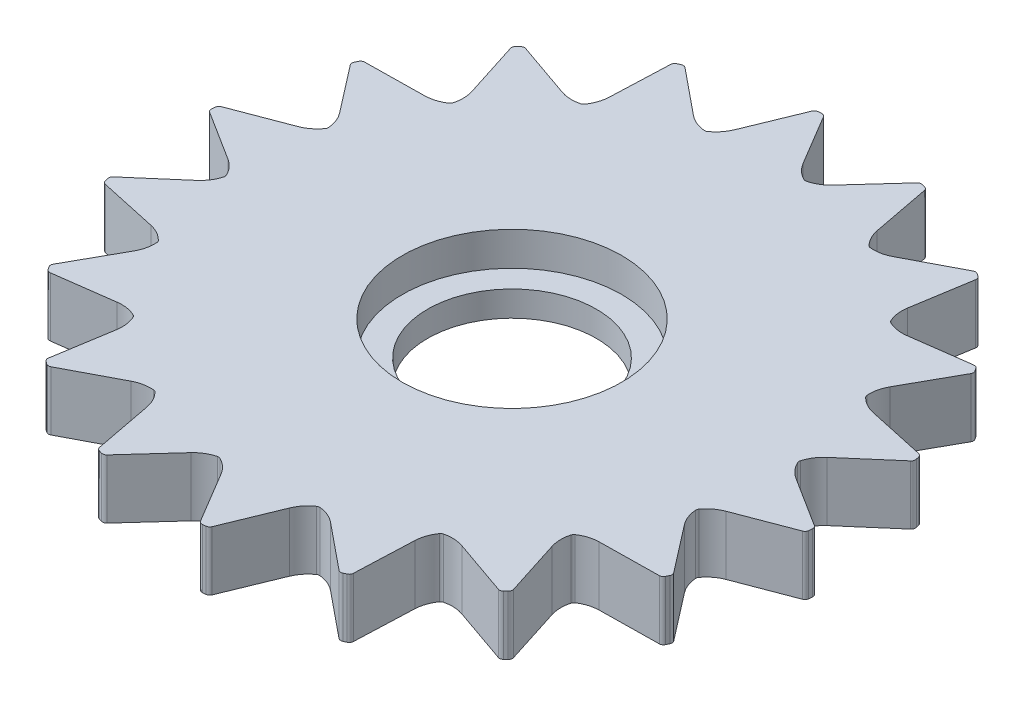
from build123d import *

# Parameters (mm, degrees)
SKETCH1_R           = 10
BOSS_EXTRUDE1_DEPTH = 7
SKETCH2_R           = 13
CUT_EXTRUDE1_DEPTH  = 4


with BuildPart() as part:
    # Sketch1 → Boss-Extrude1 (new body)
    with BuildSketch(Plane(origin=(0, 0, 0), x_dir=(1, 0, 0), z_dir=(0, 1, 0))):
        with BuildLine():
            Line((381.346685097, 381.313283118), (386.661883303, 385.905742972))
            ThreePointArc((386.661883303, 385.905742972), (387.416091655, 386.776668476), (387.890781792, 387.826435472))
            ThreePointArc((387.890781792, 387.826435472), (387.908892338, 388.001853093), (387.864976279, 388.172647453))
            ThreePointArc((387.864976279, 388.172647453), (387.239903701, 389.14044172), (386.364914825, 389.889932173))
            Line((386.364914825, 389.889932173), (380.427618413, 393.643667751))
            ThreePointArc((380.427618413, 393.643667751), (380.245877192, 393.84615623), (380.197077012, 394.113831403))
            ThreePointArc((380.197077012, 394.113831403), (380.215965011, 394.306577637), (380.235797819, 394.499228946))
            ThreePointArc((380.235797819, 394.499228946), (380.336871676, 394.751846307), (380.555261847, 394.914133672))
            Line((380.555261847, 394.914133672), (387.120628157, 397.411729455))
            ThreePointArc((387.120628157, 397.411729455), (388.127226245, 397.972177276), (388.932330522, 398.796281987))
            ThreePointArc((388.932330522, 398.796281987), (389.009345229, 398.95492646), (389.026492744, 399.130440836))
            ThreePointArc((389.026492744, 399.130440836), (388.770121789, 400.25365738), (388.204242031, 401.257211849))
            Line((388.204242031, 401.257211849), (383.908861585, 406.815244442))
            ThreePointArc((383.908861585, 406.815244442), (383.807335839, 407.06768053), (383.853028972, 407.335903559))
            ThreePointArc((383.853028972, 407.335903559), (383.936700979, 407.510565697), (384.021228351, 407.68481549))
            ThreePointArc((384.021228351, 407.68481549), (384.202606935, 407.887628866), (384.463332115, 407.965435268))
            Line((384.463332115, 407.965435268), (391.486986457, 408.066920068))
            ThreePointArc((391.486986457, 408.066920068), (392.624563696, 408.249291928), (393.662974656, 408.748335163))
            ThreePointArc((393.662974656, 408.748335163), (393.789604412, 408.871071622), (393.865747258, 409.030136391))
            ThreePointArc((393.865747258, 409.030136391), (394.009000047, 410.17329872), (393.820482857, 411.309873724))
            Line((393.820482857, 411.309873724), (391.685104653, 418.001822573))
            ThreePointArc((391.685104653, 418.001822573), (391.676039886, 418.273758753), (391.810715064, 418.510177982))
            ThreePointArc((391.810715064, 418.510177982), (391.949079002, 418.645689192), (392.088105689, 418.780520374))
            ThreePointArc((392.088105689, 418.780520374), (392.327912065, 418.909067477), (392.599524949, 418.893008315))
            Line((392.599524949, 418.893008315), (399.234310951, 416.586141569))
            ThreePointArc((399.234310951, 416.586141569), (400.365658739, 416.368440729), (401.512128694, 416.482230509))
            ThreePointArc((401.512128694, 416.482230509), (401.673100083, 416.554255127), (401.799054308, 416.677684729))
            ThreePointArc((401.799054308, 416.677684729), (402.32465244, 417.702910594), (402.536235774, 418.835418415))
            Line((402.536235774, 418.835418415), (402.818417938, 425.854135727))
            ThreePointArc((402.818417938, 425.854135727), (402.902907494, 426.112772481), (403.110320904, 426.288872263))
            ThreePointArc((403.110320904, 426.288872263), (403.286688038, 426.368887893), (403.46344537, 426.448037832))
            ThreePointArc((403.46344537, 426.448037832), (403.732755351, 426.486813985), (403.982495417, 426.378826232))
            Line((403.982495417, 426.378826232), (409.428159969, 421.941850114))
            ThreePointArc((409.428159969, 421.941850114), (410.416821063, 421.350334508), (411.533068817, 421.065146107))
            ThreePointArc((411.533068817, 421.065146107), (411.708966313, 421.077771651), (411.86953998, 421.150678655))
            ThreePointArc((411.86953998, 421.150678655), (412.714088563, 421.934310687), (413.300252348, 422.926154167))
            Line((413.300252348, 422.926154167), (415.965959546, 429.425079049))
            ThreePointArc((415.965959546, 429.425079049), (416.133812738, 429.639220968), (416.388947262, 429.733761069))
            ThreePointArc((416.388947262, 429.733761069), (416.582045114, 429.748630054), (416.775213547, 429.762552099))
            ThreePointArc((416.775213547, 429.762552099), (417.041544374, 429.706880326), (417.239289285, 429.519988898))
            Line((417.239289285, 429.519988898), (420.839004872, 423.488068211))
            ThreePointArc((420.839004872, 423.488068211), (421.565732155, 422.594083352), (422.517121754, 421.944314699))
            ThreePointArc((422.517121754, 421.944314699), (422.686729524, 421.896018342), (422.862555077, 421.909609088))
            ThreePointArc((422.862555077, 421.909609088), (423.924189089, 422.357129698), (424.814233321, 423.088677876))
            Line((424.814233321, 423.088677876), (429.541941924, 428.283944072))
            ThreePointArc((429.541941924, 428.283944072), (429.77291318, 428.427762481), (430.044995827, 428.42933997))
            ThreePointArc((430.044995827, 428.42933997), (430.231533946, 428.37726889), (430.417814518, 428.324283838))
            ThreePointArc((430.417814518, 428.324283838), (430.649042763, 428.180878975), (430.770941563, 427.937625736))
            Line((430.770941563, 427.937625736), (432.090529359, 421.038299137))
            ThreePointArc((432.090529359, 421.038299137), (432.467668795, 419.949672793), (433.139448613, 419.013695577))
            ThreePointArc((433.139448613, 419.013695577), (433.282309456, 418.910302574), (433.452179739, 418.862937816))
            ThreePointArc((433.452179739, 418.862937816), (434.60285045, 418.920369414), (435.689422659, 419.303386783))
            Line((435.689422659, 419.303386783), (441.908901235, 422.568368516))
            ThreePointArc((441.908901235, 422.568368516), (442.175132013, 422.624516792), (442.431345602, 422.5329414))
            ThreePointArc((442.431345602, 422.5329414), (442.588824738, 422.420210796), (442.745749262, 422.306709426))
            ThreePointArc((442.745749262, 422.306709426), (442.913985386, 422.092868218), (442.945335281, 421.822593099))
            Line((442.945335281, 421.822593099), (441.825633523, 414.888021198))
            ThreePointArc((441.825633523, 414.888021198), (441.807696529, 413.736057772), (442.118840005, 412.626764659))
            ThreePointArc((442.118840005, 412.626764659), (442.217722796, 412.480745731), (442.361148947, 412.378138359))
            ThreePointArc((442.361148947, 412.378138359), (443.462068485, 412.038553847), (444.614112028, 412.026842858))
            Line((444.614112028, 412.026842858), (451.575199671, 412.967735147))
            ThreePointArc((451.575199671, 412.967735147), (451.84457861, 412.929440978), (452.054020001, 412.75575805))
            ThreePointArc((452.054020001, 412.75575805), (452.163445845, 412.595964897), (452.272086907, 412.435637149))
            ThreePointArc((452.272086907, 412.435637149), (452.35703915, 412.177152), (452.294058881, 411.91245417))
            Line((452.294058881, 411.91245417), (448.870120126, 405.779048682))
            ThreePointArc((448.870120126, 405.779048682), (448.459270169, 404.702691964), (448.372248808, 403.553880076))
            ThreePointArc((448.372248808, 403.553880076), (448.415226822, 403.38284726), (448.51490953, 403.237373237))
            ThreePointArc((448.51490953, 403.237373237), (449.433290753, 402.541731518), (450.511852175, 402.136704691))
            Line((450.511852175, 402.136704691), (457.374938981, 400.640022038))
            ThreePointArc((457.374938981, 400.640022038), (457.614975004, 400.511904267), (457.752382474, 400.277062527))
            ThreePointArc((457.752382474, 400.277062527), (457.800556656, 400.089480237), (457.84781054, 399.901664003))
            ThreePointArc((457.84781054, 399.901664003), (457.839232409, 399.629712038), (457.689518325, 399.402517961))
            Line((457.689518325, 399.402517961), (452.374320118, 394.810058108))
            ThreePointArc((452.374320118, 394.810058108), (451.620111767, 393.939132604), (451.14542163, 392.889365608))
            ThreePointArc((451.14542163, 392.889365608), (451.127311084, 392.713947987), (451.171227142, 392.543153627))
            ThreePointArc((451.171227142, 392.543153627), (451.79629972, 391.575359359), (452.671288596, 390.825868907))
            Line((452.671288596, 390.825868907), (458.608585009, 387.072133329))
            ThreePointArc((458.608585009, 387.072133329), (458.79032623, 386.86964485), (458.839126409, 386.601969677))
            ThreePointArc((458.839126409, 386.601969677), (458.820238411, 386.409223443), (458.800405602, 386.216572134))
            ThreePointArc((458.800405602, 386.216572134), (458.699331746, 385.963954772), (458.480941575, 385.801667407))
            Line((458.480941575, 385.801667407), (451.915575265, 383.304071624))
            ThreePointArc((451.915575265, 383.304071624), (450.908977177, 382.743623803), (450.103872899, 381.919519092))
            ThreePointArc((450.103872899, 381.919519092), (450.026858193, 381.76087462), (450.009710678, 381.585360243))
            ThreePointArc((450.009710678, 381.585360243), (450.266081633, 380.462143699), (450.831961391, 379.458589231))
            Line((450.831961391, 379.458589231), (455.127341836, 373.900556638))
            ThreePointArc((455.127341836, 373.900556638), (455.228867582, 373.64812055), (455.18317445, 373.37989752))
            ThreePointArc((455.18317445, 373.37989752), (455.099502442, 373.205235383), (455.01497507, 373.030985589))
            ThreePointArc((455.01497507, 373.030985589), (454.833596487, 372.828172214), (454.572871307, 372.750365812))
            Line((454.572871307, 372.750365812), (447.549216965, 372.648881011))
            ThreePointArc((447.549216965, 372.648881011), (446.411639725, 372.466509152), (445.373228766, 371.967465917))
            ThreePointArc((445.373228766, 371.967465917), (445.246599009, 371.844729457), (445.170456163, 371.685664689))
            ThreePointArc((445.170456163, 371.685664689), (445.027203375, 370.54250236), (445.215720564, 369.405927355))
            Line((445.215720564, 369.405927355), (447.351098768, 362.713978506))
            ThreePointArc((447.351098768, 362.713978506), (447.360163536, 362.442042326), (447.225488357, 362.205623097))
            ThreePointArc((447.225488357, 362.205623097), (447.08712442, 362.070111887), (446.948097733, 361.935280706))
            ThreePointArc((446.948097733, 361.935280706), (446.708291357, 361.806733603), (446.436678472, 361.822792764))
            Line((446.436678472, 361.822792764), (439.80189247, 364.12965951))
            ThreePointArc((439.80189247, 364.12965951), (438.670544683, 364.347360351), (437.524074728, 364.23357057))
            ThreePointArc((437.524074728, 364.23357057), (437.363103339, 364.161545953), (437.237149114, 364.03811635))
            ThreePointArc((437.237149114, 364.03811635), (436.711550982, 363.012890485), (436.499967648, 361.880382664))
            Line((436.499967648, 361.880382664), (436.217785484, 354.861665352))
            ThreePointArc((436.217785484, 354.861665352), (436.133295928, 354.603028598), (435.925882518, 354.426928816))
            ThreePointArc((435.925882518, 354.426928816), (435.749515384, 354.346913186), (435.572758052, 354.267763247))
            ThreePointArc((435.572758052, 354.267763247), (435.303448071, 354.228987094), (435.053708004, 354.336974848))
            Line((435.053708004, 354.336974848), (429.608043453, 358.773950966))
            ThreePointArc((429.608043453, 358.773950966), (428.619382358, 359.365466571), (427.503134605, 359.650654972))
            ThreePointArc((427.503134605, 359.650654972), (427.327237108, 359.638029428), (427.166663442, 359.565122424))
            ThreePointArc((427.166663442, 359.565122424), (426.322114858, 358.781490392), (425.735951073, 357.789646912))
            Line((425.735951073, 357.789646912), (423.070243876, 351.290722031))
            ThreePointArc((423.070243876, 351.290722031), (422.902390684, 351.076580111), (422.64725616, 350.98204001))
            ThreePointArc((422.64725616, 350.98204001), (422.454158308, 350.967171026), (422.260989874, 350.95324898))
            ThreePointArc((422.260989874, 350.95324898), (421.994659047, 351.008920754), (421.796914136, 351.195812182))
            Line((421.796914136, 351.195812182), (418.19719855, 357.227732869))
            ThreePointArc((418.19719855, 357.227732869), (417.470471267, 358.121717728), (416.519081668, 358.771486381))
            ThreePointArc((416.519081668, 358.771486381), (416.349473898, 358.819782737), (416.173648345, 358.806191991))
            ThreePointArc((416.173648345, 358.806191991), (415.112014333, 358.358671381), (414.2219701, 357.627123204))
            Line((414.2219701, 357.627123204), (409.494261498, 352.431857007))
            ThreePointArc((409.494261498, 352.431857007), (409.263290242, 352.288038599), (408.991207594, 352.28646111))
            ThreePointArc((408.991207594, 352.28646111), (408.804669475, 352.33853219), (408.618388904, 352.391517242))
            ThreePointArc((408.618388904, 352.391517242), (408.387160659, 352.534922104), (408.265261858, 352.778175343))
            Line((408.265261858, 352.778175343), (406.945674063, 359.677501942))
            ThreePointArc((406.945674063, 359.677501942), (406.568534627, 360.766128287), (405.896754809, 361.702105502))
            ThreePointArc((405.896754809, 361.702105502), (405.753893966, 361.805498506), (405.584023682, 361.852863263))
            ThreePointArc((405.584023682, 361.852863263), (404.433352972, 361.795431665), (403.346780762, 361.412414297))
            Line((403.346780762, 361.412414297), (397.127302186, 358.147432563))
            ThreePointArc((397.127302186, 358.147432563), (396.861071409, 358.091284288), (396.604857819, 358.182859679))
            ThreePointArc((396.604857819, 358.182859679), (396.447378684, 358.295590283), (396.29045416, 358.409091653))
            ThreePointArc((396.29045416, 358.409091653), (396.122218036, 358.622932862), (396.09086814, 358.89320798))
            Line((396.09086814, 358.89320798), (397.210569899, 365.827779881))
            ThreePointArc((397.210569899, 365.827779881), (397.228506893, 366.979743308), (396.917363416, 368.08903642))
            ThreePointArc((396.917363416, 368.08903642), (396.818480626, 368.235055348), (396.675054475, 368.33766272))
            ThreePointArc((396.675054475, 368.33766272), (395.574134936, 368.677247232), (394.422091394, 368.688958221))
            Line((394.422091394, 368.688958221), (387.46100375, 367.748065933))
            ThreePointArc((387.46100375, 367.748065933), (387.191624812, 367.786360101), (386.982183421, 367.96004303))
            ThreePointArc((386.982183421, 367.96004303), (386.872757577, 368.119836182), (386.764116515, 368.280163931))
            ThreePointArc((386.764116515, 368.280163931), (386.679164271, 368.538649079), (386.74214454, 368.80334691))
            Line((386.74214454, 368.80334691), (390.166083296, 374.936752397))
            ThreePointArc((390.166083296, 374.936752397), (390.576933253, 376.013109116), (390.663954613, 377.161921004))
            ThreePointArc((390.663954613, 377.161921004), (390.6209766, 377.332953819), (390.521293892, 377.478427842))
            ThreePointArc((390.521293892, 377.478427842), (389.602912669, 378.174069561), (388.524351247, 378.579096388))
            Line((388.524351247, 378.579096388), (381.661264441, 380.075779041))
            ThreePointArc((381.661264441, 380.075779041), (381.421228417, 380.203896812), (381.283820948, 380.438738553))
            ThreePointArc((381.283820948, 380.438738553), (381.235646766, 380.626320842), (381.188392881, 380.814137076))
            ThreePointArc((381.188392881, 380.814137076), (381.196971013, 381.086089041), (381.346685097, 381.313283118))
        make_face()
        with Locations(Location((419.518101711, 390.35790054, 0), (0, 0, 270))):
            Circle(SKETCH1_R, mode=Mode.SUBTRACT)
    extrude(amount=BOSS_EXTRUDE1_DEPTH)

    # Sketch2 → Cut-Extrude1 (cut)
    with BuildSketch(Plane(origin=(0, 7, 0), x_dir=(1, 0, 0), z_dir=(0, 1, 0))):
        with Locations(Location((419.518101711, 390.35790054, 0), (0, 0, 270))):
            Circle(SKETCH2_R)
    extrude(amount=-CUT_EXTRUDE1_DEPTH, mode=Mode.SUBTRACT)


solid = part.part
